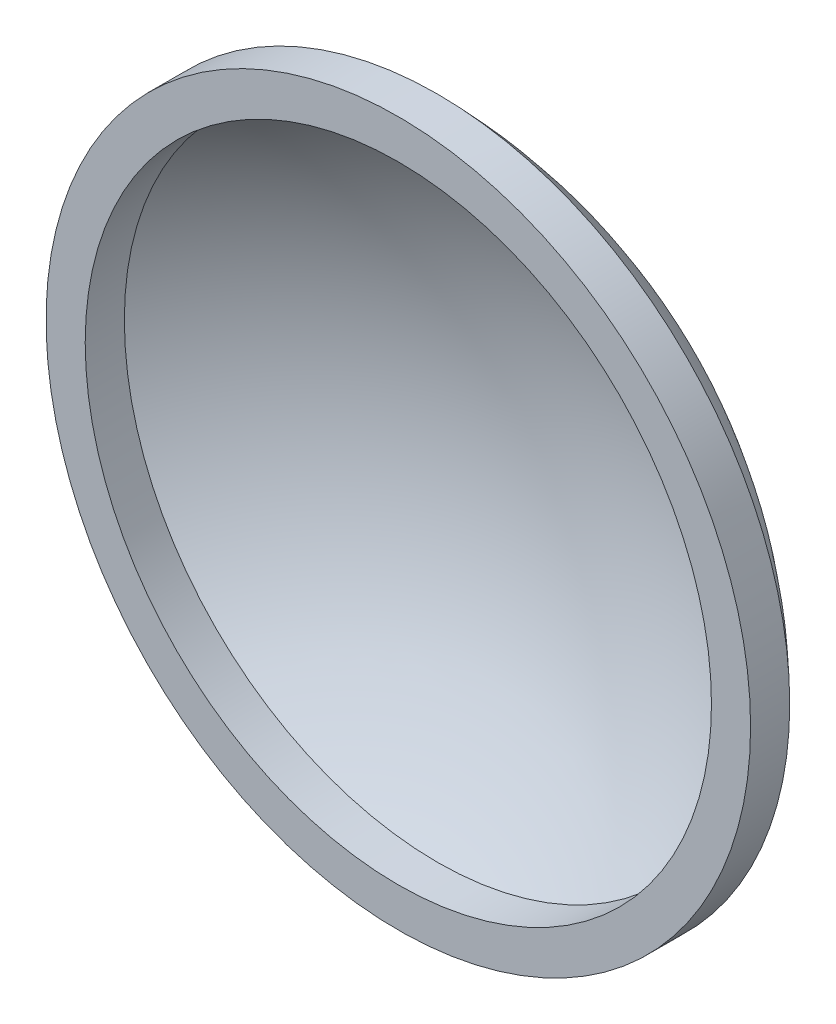
from build123d import *


with BuildPart() as part:
    # Sketch1 → Revolve1 (revolve)
    with BuildSketch(Plane(origin=(0, 0, 0), x_dir=(0, 0, -1), z_dir=(1, 0, 0)), mode=Mode.PRIVATE) as revolve1_sk:
        with BuildLine():
            Line((0, 45), (0, 40))
            Line((0, 40), (5, 40))
            ThreePointArc((5, 40), (16.126691635, 21.360009363), (20, 0))
            Line((20, 0), (23.398235575, 0))
            ThreePointArc((23.398235575, 0), (18.621024593, 24.30789518), (5, 45))
            Line((5, 45), (0, 45))
        make_face()
    revolve(revolve1_sk.sketch.rotate(Axis((0, 0, 0), (0, 0, -1)), 90), axis=Axis((0, 0, 0), (0, 0, -1)))


solid = part.part
